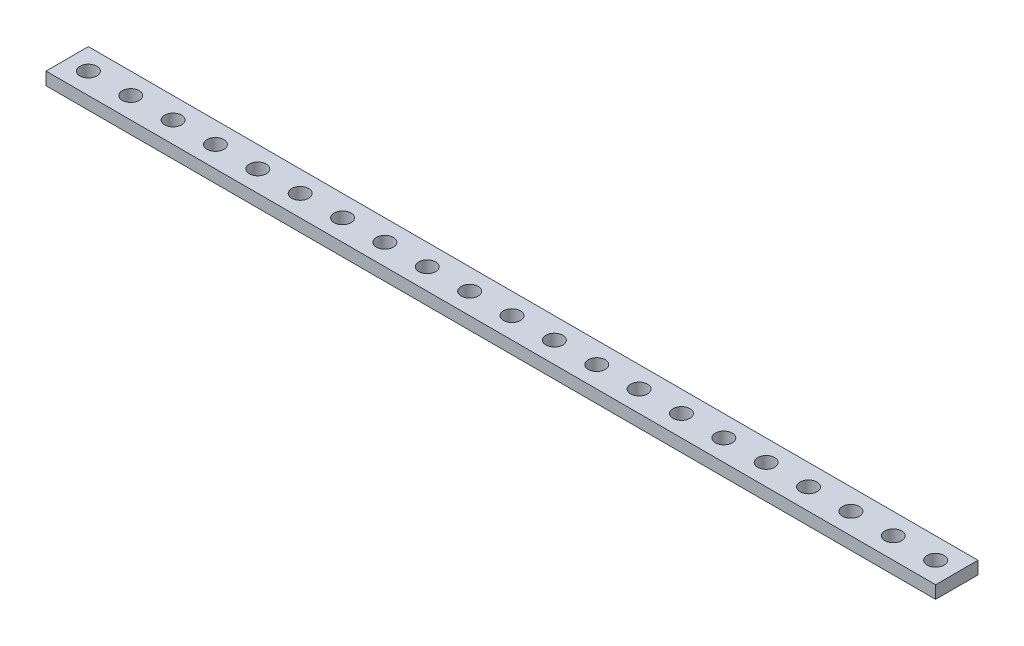
from build123d import *

# Parameters (mm, degrees)
ESQUISSE1_R             = 2
BOSS_EXTRU_1_DEPTH      = 3
ENL_V_MAT_EXTRU_1_REACH = 142.389
ESQUISSE2_W             = 70
ESQUISSE2_H             = 10


with BuildPart() as part:
    # Esquisse1 → Boss.-Extru.1 (new body)
    with BuildSketch(Plane(origin=(0, 0, 0), x_dir=(1, 0, 0), z_dir=(0, 1, 0))):
        Polygon((0, 0), (140, 0), (140, 10), (-140, 10), (-140, 0), align=None)
        with Locations(Location((-135, 5, 0), (0, 0, 270))):
            Circle(ESQUISSE1_R, mode=Mode.SUBTRACT)
        with Locations(Location((-125, 5, 0), (0, 0, 270))):
            Circle(ESQUISSE1_R, mode=Mode.SUBTRACT)
        with Locations(Location((-115, 5, 0), (0, 0, 270))):
            Circle(ESQUISSE1_R, mode=Mode.SUBTRACT)
        with Locations(Location((-105, 5, 0), (0, 0, 270))):
            Circle(ESQUISSE1_R, mode=Mode.SUBTRACT)
        with Locations(Location((-95, 5, 0), (0, 0, 270))):
            Circle(ESQUISSE1_R, mode=Mode.SUBTRACT)
        with Locations(Location((-85, 5, 0), (0, 0, 270))):
            Circle(ESQUISSE1_R, mode=Mode.SUBTRACT)
        with Locations(Location((-75, 5, 0), (0, 0, 270))):
            Circle(ESQUISSE1_R, mode=Mode.SUBTRACT)
        with Locations(Location((-65, 5, 0), (0, 0, 270))):
            Circle(ESQUISSE1_R, mode=Mode.SUBTRACT)
        with Locations(Location((-55, 5, 0), (0, 0, 270))):
            Circle(ESQUISSE1_R, mode=Mode.SUBTRACT)
        with Locations(Location((-45, 5, 0), (0, 0, 270))):
            Circle(ESQUISSE1_R, mode=Mode.SUBTRACT)
        with Locations(Location((-35, 5, 0), (0, 0, 270))):
            Circle(ESQUISSE1_R, mode=Mode.SUBTRACT)
        with Locations(Location((-25, 5, 0), (0, 0, 270))):
            Circle(ESQUISSE1_R, mode=Mode.SUBTRACT)
        with Locations(Location((-15, 5, 0), (0, 0, 270))):
            Circle(ESQUISSE1_R, mode=Mode.SUBTRACT)
        with Locations(Location((-5, 5, 0), (0, 0, 270))):
            Circle(ESQUISSE1_R, mode=Mode.SUBTRACT)
        with Locations(Location((5, 5, 0), (0, 0, 270))):
            Circle(ESQUISSE1_R, mode=Mode.SUBTRACT)
        with Locations(Location((15, 5, 0), (0, 0, 270))):
            Circle(ESQUISSE1_R, mode=Mode.SUBTRACT)
        with Locations(Location((25, 5, 0), (0, 0, 270))):
            Circle(ESQUISSE1_R, mode=Mode.SUBTRACT)
        with Locations(Location((35, 5, 0), (0, 0, 270))):
            Circle(ESQUISSE1_R, mode=Mode.SUBTRACT)
        with Locations(Location((45, 5, 0), (0, 0, 270))):
            Circle(ESQUISSE1_R, mode=Mode.SUBTRACT)
        with Locations(Location((55, 5, 0), (0, 0, 270))):
            Circle(ESQUISSE1_R, mode=Mode.SUBTRACT)
        with Locations(Location((65, 5, 0), (0, 0, 270))):
            Circle(ESQUISSE1_R, mode=Mode.SUBTRACT)
        with Locations(Location((75, 5, 0), (0, 0, 270))):
            Circle(ESQUISSE1_R, mode=Mode.SUBTRACT)
        with Locations(Location((85, 5, 0), (0, 0, 270))):
            Circle(ESQUISSE1_R, mode=Mode.SUBTRACT)
        with Locations(Location((95, 5, 0), (0, 0, 270))):
            Circle(ESQUISSE1_R, mode=Mode.SUBTRACT)
        with Locations(Location((105, 5, 0), (0, 0, 270))):
            Circle(ESQUISSE1_R, mode=Mode.SUBTRACT)
        with Locations(Location((115, 5, 0), (0, 0, 270))):
            Circle(ESQUISSE1_R, mode=Mode.SUBTRACT)
        with Locations(Location((125, 5, 0), (0, 0, 270))):
            Circle(ESQUISSE1_R, mode=Mode.SUBTRACT)
        with Locations(Location((135, 5, 0), (0, 0, 270))):
            Circle(ESQUISSE1_R, mode=Mode.SUBTRACT)
    extrude(amount=BOSS_EXTRU_1_DEPTH)

    # Esquisse2 → Enlèv. mat.-Extru.1 (cut, up to next)
    with BuildSketch(Plane(origin=(0, 3, 0), x_dir=(1, 0, 0), z_dir=(0, 1, 0)), mode=Mode.PRIVATE) as enl_v_mat_extru_1_sk1:
        with Locations((105, 5)):
            Rectangle(ESQUISSE2_W, ESQUISSE2_H)
    enl_v_mat_extru_1_tool1 = extrude(enl_v_mat_extru_1_sk1.sketch, amount=-ENL_V_MAT_EXTRU_1_REACH, mode=Mode.PRIVATE) & part.part
    add(enl_v_mat_extru_1_tool1.solids().sort_by_distance((105, 3, -5))[0], mode=Mode.SUBTRACT)


solid = part.part
